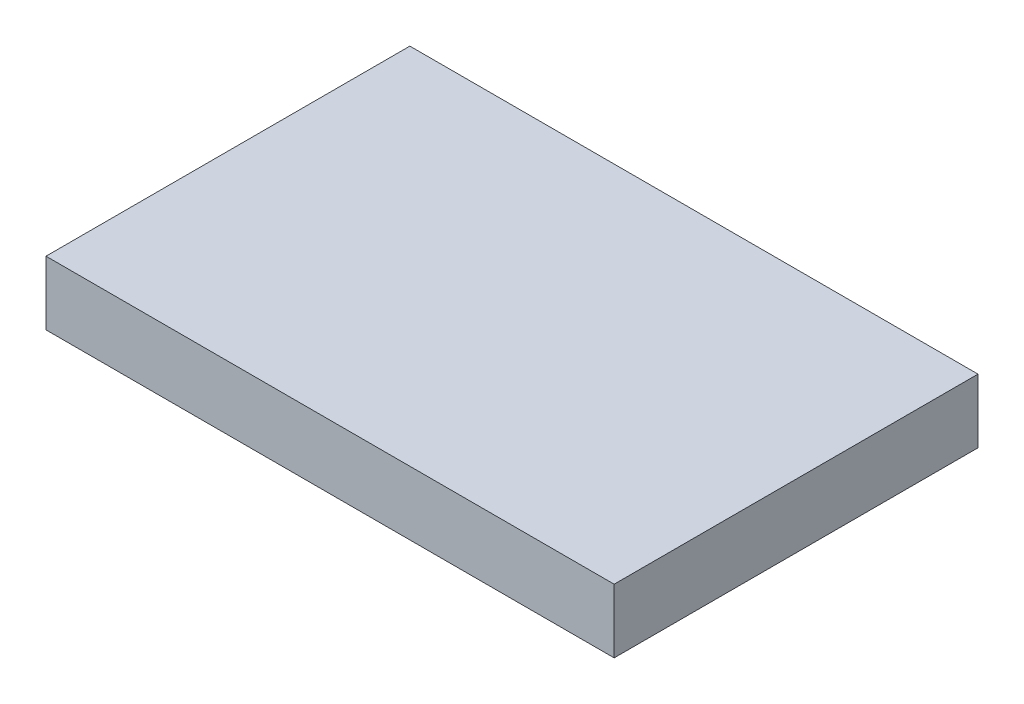
from build123d import *

# Parameters (mm, degrees)
SKETCH1_W           = 89
SKETCH1_H           = 57
BOSS_EXTRUDE1_DEPTH = 10


with BuildPart() as part:
    # Sketch1 → Boss-Extrude1 (new body)
    with BuildSketch(Plane(origin=(0, 0, 0), x_dir=(1, 0, 0), z_dir=(0, 1, 0))):
        with Locations((-4.531719533, 2.349749583)):
            Rectangle(SKETCH1_W, SKETCH1_H)
    extrude(amount=BOSS_EXTRUDE1_DEPTH)


solid = part.part
